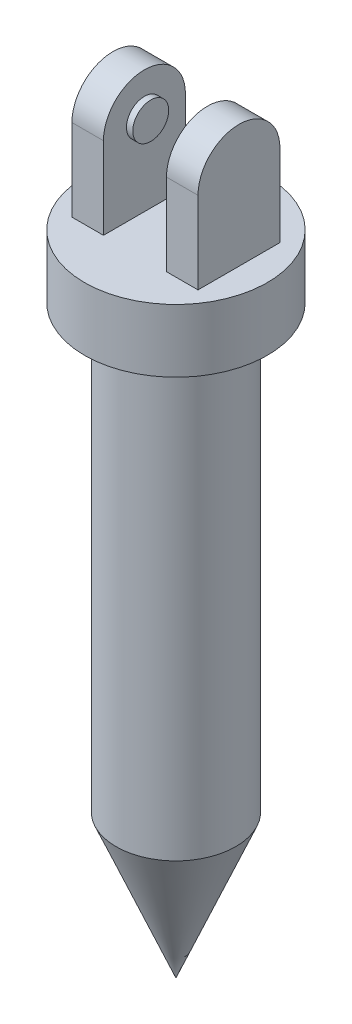
from build123d import *

# Parameters (mm, degrees)
SKETCH1_R           = 14.5
BOSS_EXTRUDE1_DEPTH = 10
BOSS_EXTRUDE2_DEPTH = 20
CUT_EXTRUDE1_DEPTH  = 20
SKETCH5_W           = 10
SKETCH5_H           = 20
CUT_EXTRUDE2_DEPTH  = 20
SKETCH6_R           = 2.85
BOSS_EXTRUDE3_DEPTH = 1
SCALE1_SCALE        = 0.5
SKETCH7_R           = 4.75
BOSS_EXTRUDE4_DEPTH = 35


with BuildPart() as part:
    # Sketch1 → Boss-Extrude1 (new body)
    with BuildSketch(Plane(origin=(0, 0, 0), x_dir=(1, 0, 0), z_dir=(0, 1, 0))):
        with Locations(Location((0, 0, 0), (0, 0, 270))):
            Circle(SKETCH1_R)
    extrude(amount=BOSS_EXTRUDE1_DEPTH)

    # Sketch2 → Boss-Extrude2 (add)
    with BuildSketch(Plane(origin=(0, 10, 0), x_dir=(1, 0, 0), z_dir=(0, 1, 0))):
        Polygon((-10, 0), (-10, 10), (10, 10), (10, -10), (-10, -10), align=None)
    extrude(amount=BOSS_EXTRUDE2_DEPTH)

    # Sketch3 → Cut-Extrude1 (cut)
    with BuildSketch(Plane.ZY.offset(10)):
        with BuildLine():
            Line((-6.5, 23), (-6.5, 10))
            Line((-6.5, 10), (-10, 10))
            Line((-10, 10), (-10, 30))
            Line((-10, 30), (10, 30))
            Line((10, 30), (10, 10))
            Line((10, 10), (6.5, 10))
            Line((6.5, 10), (6.5, 23))
            ThreePointArc((6.5, 23), (0, 29.5), (-6.5, 23))
        make_face()
    extrude(amount=-CUT_EXTRUDE1_DEPTH, mode=Mode.SUBTRACT)

    # Sketch5 → Cut-Extrude2 (cut)
    with BuildSketch(Plane.XY.offset(6.5)):
        with Locations((0, 20)):
            Rectangle(SKETCH5_W, SKETCH5_H)
    extrude(amount=-CUT_EXTRUDE2_DEPTH, mode=Mode.SUBTRACT)

    # Sketch6 → Boss-Extrude3 (add)
    with BuildSketch(Plane(origin=(-5, 0, 0), x_dir=(0, 0, -1), z_dir=(1, 0, 0))):
        with Locations(Location((0, 23, 0), (0, 0, 270))):
            Circle(SKETCH6_R)
    boss_extrude3 = extrude(amount=BOSS_EXTRUDE3_DEPTH)

    # Mirror1: Boss-Extrude3 across plane
    add(boss_extrude3.mirror(Plane(origin=(0, 0, 0), x_dir=(0, 0, 1), z_dir=(1, 0, 0))))


with BuildPart() as part_1:
    # Scale1: scaled about (0, 0, 0)
    add(part.part.scale(SCALE1_SCALE))

    # Sketch7 → Boss-Extrude4 (add)
    with BuildSketch(Plane.XZ):
        with Locations(Location((0, 0, 0), (0, 0, 270))):
            Circle(SKETCH7_R)
    extrude(amount=BOSS_EXTRUDE4_DEPTH)

    # Sketch8 → Revolve1 (revolve)
    with BuildSketch(Plane.XY, mode=Mode.PRIVATE) as revolve1_sk:
        Polygon((0, -35), (4.75, -35), (0, -46.4), align=None)
    revolve(revolve1_sk.sketch.rotate(Axis((0, -35, 0), (0, -1, 0)), 90), axis=Axis((0, -35, 0), (0, -1, 0)))


solid = part_1.part
